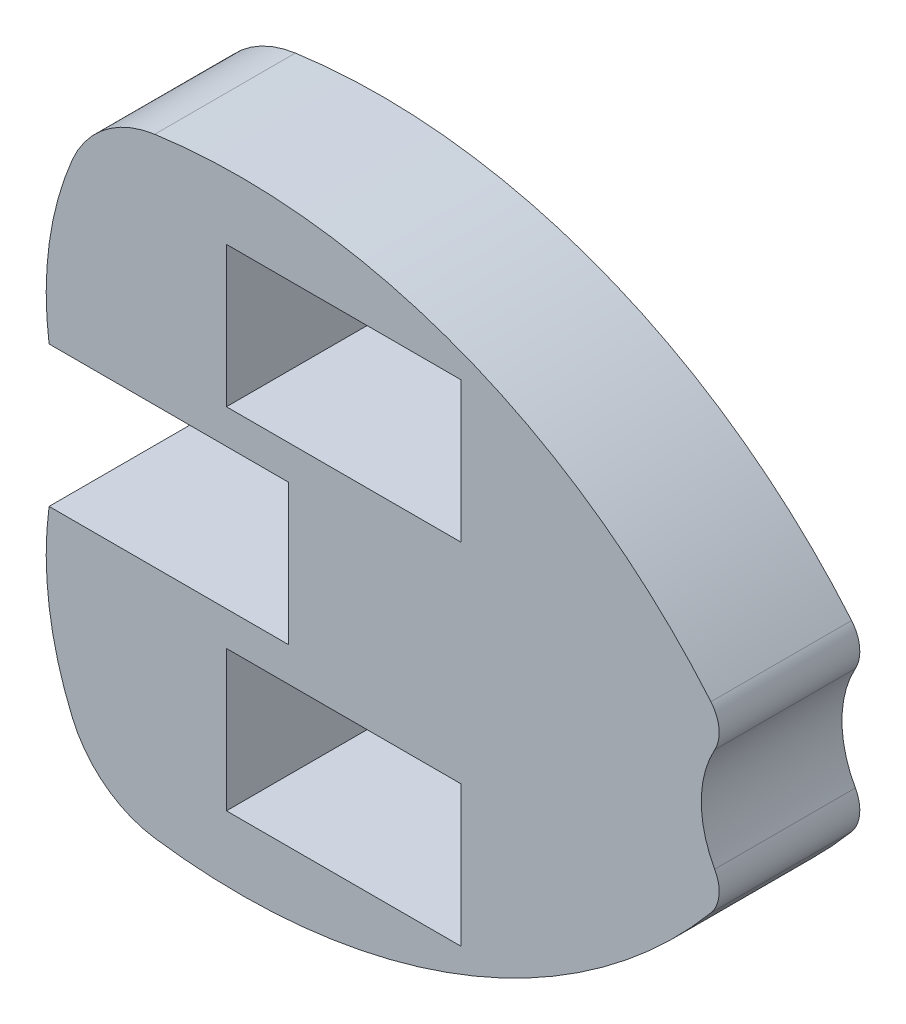
from build123d import *

# Parameters (mm, degrees)
SKETCH1_W           = 2.54
SKETCH1_H           = 1.524
BOSS_EXTRUDE1_DEPTH = 1.524


with BuildPart() as part:
    # Sketch1 → Boss-Extrude1 (new body)
    with BuildSketch(Plane.XY):
        with BuildLine():
            Line((109.975938606, -1.524), (107.383711033, -1.524))
            ThreePointArc((107.383711033, -1.524), (107.384970604, -2.46941588), (107.636449137, -3.380772737))
            ThreePointArc((107.636449137, -3.380772737), (107.992708895, -3.839670187), (108.528537329, -4.064160218))
            ThreePointArc((108.528537329, -4.064160218), (111.840473047, -3.687536777), (114.554773872, -1.752766908))
            ThreePointArc((114.554773872, -1.752766908), (114.642277966, -1.543971247), (114.595869935, -1.322388556))
            ThreePointArc((114.595869935, -1.322388556), (114.450356485, -0.762), (114.595869935, -0.201611444))
            ThreePointArc((114.595869935, -0.201611444), (114.642277966, 0.019971247), (114.554773872, 0.228766908))
            ThreePointArc((114.554773872, 0.228766908), (111.840473047, 2.163536777), (108.528537329, 2.540160218))
            ThreePointArc((108.528537329, 2.540160218), (107.992708895, 2.315670187), (107.636449137, 1.856772737))
            ThreePointArc((107.636449137, 1.856772737), (107.384970604, 0.94541588), (107.383711033, 0))
            Line((107.383711033, 0), (109.975938606, 0))
            Line((109.975938606, 0), (109.975938606, -1.524))
        make_face()
        with Locations((110.575658384, 1.133758123)):
            Rectangle(SKETCH1_W, SKETCH1_H, mode=Mode.SUBTRACT)
        with Locations((110.575658384, -2.657758123)):
            Rectangle(SKETCH1_W, SKETCH1_H, mode=Mode.SUBTRACT)
    extrude(amount=BOSS_EXTRUDE1_DEPTH)


solid = part.part
